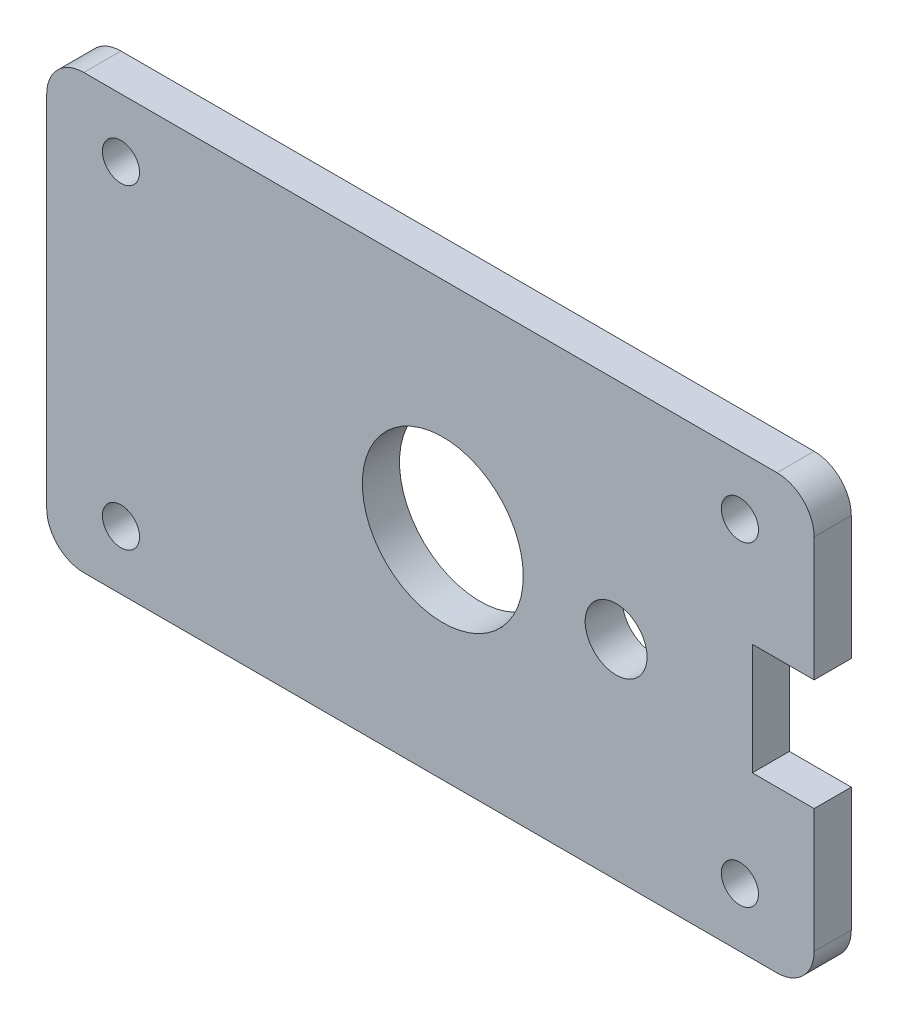
from build123d import *

# Parameters (mm, degrees)
SKETCH1_R           = 2.5
SKETCH1_R_2         = 6.5
SKETCH1_R_3         = 1.5
BOSS_EXTRUDE1_DEPTH = 3


with BuildPart() as part:
    # Sketch1 → Boss-Extrude1 (new body)
    with BuildSketch(Plane.XY):
        with BuildLine():
            Line((31, 4.5), (26, 4.5))
            Line((26, 4.5), (26, -4.5))
            Line((26, -4.5), (31, -4.5))
            Line((31, -4.5), (31, -14.5))
            ThreePointArc((31, -14.5), (30.121320344, -16.621320344), (28, -17.5))
            Line((28, -17.5), (-28, -17.5))
            ThreePointArc((-28, -17.5), (-30.121320344, -16.621320344), (-31, -14.5))
            Line((-31, -14.5), (-31, 14.5))
            ThreePointArc((-31, 14.5), (-30.121320344, 16.621320344), (-28, 17.5))
            Line((-28, 17.5), (28, 17.5))
            ThreePointArc((28, 17.5), (30.121320344, 16.621320344), (31, 14.5))
            Line((31, 14.5), (31, 4.5))
        make_face()
        with Locations((15, -0.654521384)):
            Circle(SKETCH1_R, mode=Mode.SUBTRACT)
        with Locations((1, 0)):
            Circle(SKETCH1_R_2, mode=Mode.SUBTRACT)
        with Locations((-25, 12.75)):
            Circle(SKETCH1_R_3, mode=Mode.SUBTRACT)
        with Locations((25, 12.75)):
            Circle(SKETCH1_R_3, mode=Mode.SUBTRACT)
        with Locations((25, -12.75)):
            Circle(SKETCH1_R_3, mode=Mode.SUBTRACT)
        with Locations((-25, -12.75)):
            Circle(SKETCH1_R_3, mode=Mode.SUBTRACT)
    extrude(amount=BOSS_EXTRUDE1_DEPTH)


solid = part.part
